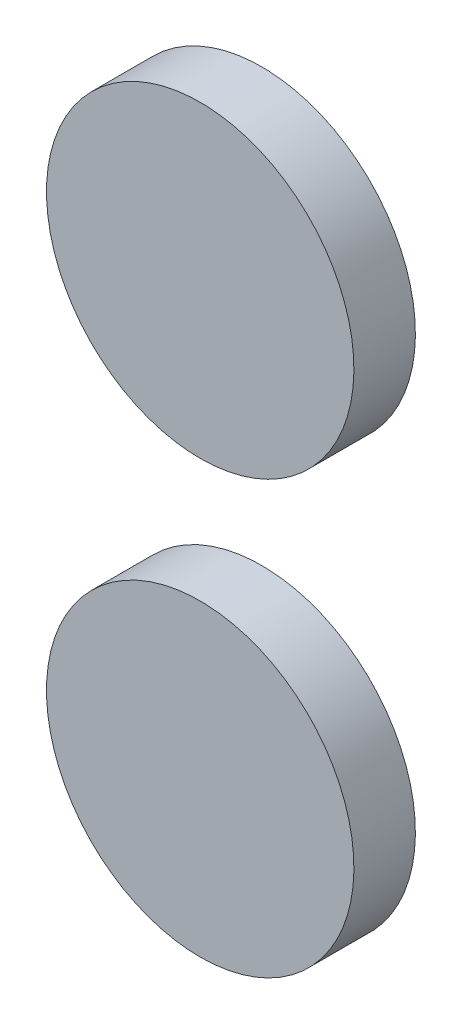
from build123d import *

# Parameters (mm, degrees)
ESQUISSE1_RX         = 1.254332769
ESQUISSE1_RY         = 1.25
BOSS_EXTRU_1_DEPTH   = 0.5
BOSS_EXTRU_1_2_DEPTH = 0.5


with BuildPart() as part:
    # Esquisse1 → Boss.-Extru.1 (new body)
    with BuildSketch(Plane.XY):
        with Locations(Location((5.4, 61.266600666), (0, 0, -90))):
            Ellipse(ESQUISSE1_RX, ESQUISSE1_RY)
    extrude(amount=BOSS_EXTRU_1_DEPTH)


with BuildPart() as body_2:
    # Esquisse1 → Boss.-Extru.1 2 (new body)
    with BuildSketch(Plane.XY):
        with Locations(Location((5.4, 57.754468914), (0, 0, -90))):
            Ellipse(ESQUISSE1_RX, ESQUISSE1_RY)
    extrude(amount=BOSS_EXTRU_1_2_DEPTH)


solid = Compound([part.part, body_2.part])
